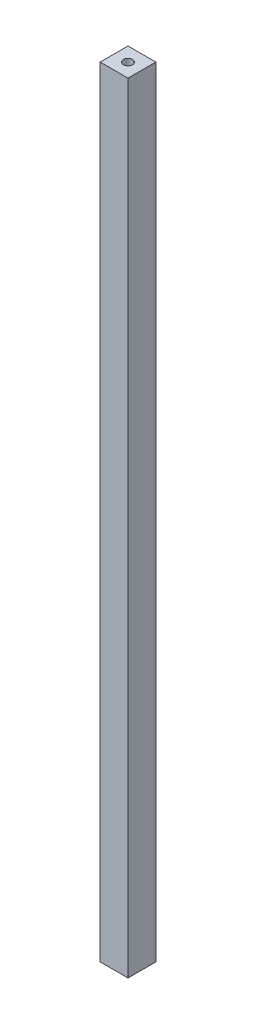
from build123d import *

# Parameters (mm, degrees)
SKETCH1_W           = 15
SKETCH1_H           = 15
SKETCH1_R           = 2.5
BOSS_EXTRUDE1_DEPTH = 420


with BuildPart() as part:
    # Sketch1 → Boss-Extrude1 (new body)
    with BuildSketch(Plane(origin=(0, 0, 0), x_dir=(1, 0, 0), z_dir=(0, 1, 0))):
        Rectangle(SKETCH1_W, SKETCH1_H)
        with Locations(Location((0, 0, 0), (0, 0, 270))):
            Circle(SKETCH1_R, mode=Mode.SUBTRACT)
    extrude(amount=BOSS_EXTRUDE1_DEPTH)


solid = part.part
